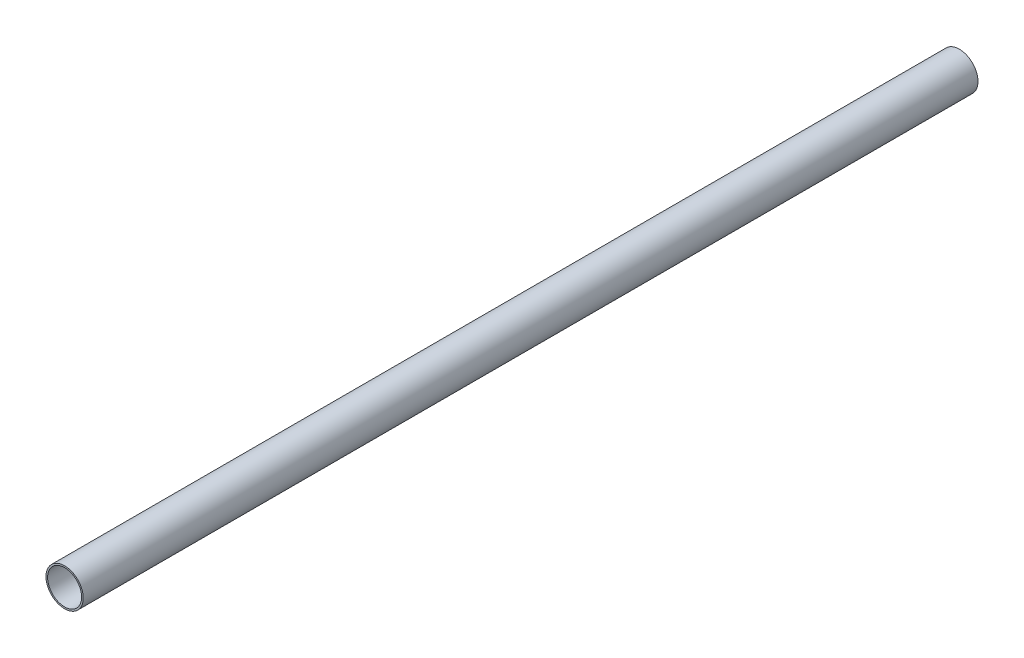
from build123d import *

# Parameters (mm, degrees)
SKETCH3_R           = 19.05
SKETCH3_R_2         = 17.399
BOSS_EXTRUDE1_DEPTH = 457.2


with BuildPart() as part:
    # Sketch3 → Boss-Extrude1 (new, symmetric)
    with BuildSketch(Plane.XY):
        Circle(SKETCH3_R)
        Circle(SKETCH3_R_2, mode=Mode.SUBTRACT)
    extrude(amount=BOSS_EXTRUDE1_DEPTH, both=True)


solid = part.part
